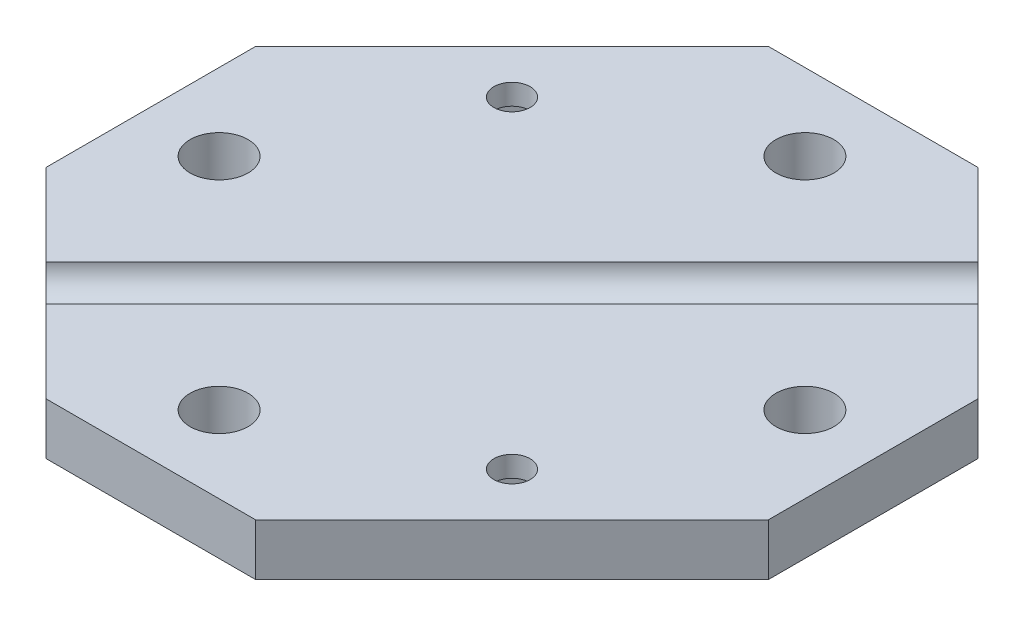
from build123d import *

# Parameters (mm, degrees)
SKETCH1_R           = 2.8
BOSS_EXTRUDE1_DEPTH = 5
CUT_EXTRUDE1_REACH  = 80.329
CUT_EXTRUDE2_START  = -2
CUT_EXTRUDE2_DEPTH  = 3
CUT_EXTRUDE3_REACH  = 59.217
SKETCH6_R           = 1.75


with BuildPart() as part:
    # Sketch1 → Boss-Extrude1 (new body)
    with BuildSketch(Plane(origin=(0, 0, 0), x_dir=(1, 0, 0), z_dir=(0, 1, 0))):
        Polygon((-40.303943114, 15.555205773), (-15.555205773, 40.303943114), (4.694794227, 40.303943114), (24.042773974, 20.955963368), (24.042773974, 0.705963368), (-0.705963368, -24.042773974), (-20.955963368, -24.042773974), (-40.303943114, -4.694794227), align=None)
        with Locations(Location((-11.666118476, -16.618152771, 0), (0, 0, 270))):
            Circle(SKETCH1_R, mode=Mode.SUBTRACT)
        with Locations(Location((16.618152771, 11.666118476, 0), (0, 0, 270))):
            Circle(SKETCH1_R, mode=Mode.SUBTRACT)
        with Locations(Location((-4.595050664, 32.879321912, 0), (0, 0, 270))):
            Circle(SKETCH1_R, mode=Mode.SUBTRACT)
        with Locations(Location((-32.879321912, 4.595050664, 0), (0, 0, 270))):
            Circle(SKETCH1_R, mode=Mode.SUBTRACT)
    extrude(amount=BOSS_EXTRUDE1_DEPTH)

    # Sketch4 → Cut-Extrude1 (cut, up to next)
    with BuildSketch(Plane(origin=(22.499368671, 0, -22.499368671), x_dir=(-0.7071067811865465, 0, -0.7071067811865487), z_dir=(0.7071067811865487, 0, -0.7071067811865465)), mode=Mode.PRIVATE) as cut_extrude1_sk1:
        with BuildLine():
            Line((13.998382969, 5), (8.998382969, 5))
            ThreePointArc((8.998382969, 5), (11.498382969, 2.5), (13.998382969, 5))
        make_face()
    cut_extrude1_tool1 = extrude(cut_extrude1_sk1.sketch, amount=-CUT_EXTRUDE1_REACH, mode=Mode.PRIVATE) & part.part
    add(cut_extrude1_tool1.solids().sort_by_distance((14.368784, 3.938967, -30.629953))[0], mode=Mode.SUBTRACT)

    # Sketch5 → Cut-Extrude2 (cut)
    with BuildSketch(Plane(origin=(0, 5, 0), x_dir=(1, 0, 0), z_dir=(0, 1, 0)).offset(CUT_EXTRUDE2_START)):
        Polygon((-21.359918501, 26.013949012), (-24.538680455, 26.865695711), (-26.865695711, 24.538680455), (-26.013949012, 21.359918501), (-22.835187058, 20.508171802), (-20.508171802, 22.835187058), align=None)
        Polygon((9.752779871, -5.09874936), (6.574017917, -4.247002661), (4.247002661, -6.574017917), (5.09874936, -9.752779871), (8.277511314, -10.60452657), (10.60452657, -8.277511314), align=None)
    extrude(amount=-CUT_EXTRUDE2_DEPTH, mode=Mode.SUBTRACT)

    # Sketch6 → Cut-Extrude3 (cut, up to next)
    with BuildSketch(Plane(origin=(0, 5, 0), x_dir=(1, 0, 0), z_dir=(0, 1, 0)), mode=Mode.PRIVATE) as cut_extrude3_sk1:
        with Locations(Location((-23.686933757, 23.686933757, 0), (0, 0, 270))):
            Circle(SKETCH6_R)
    cut_extrude3_tool1 = extrude(cut_extrude3_sk1.sketch, amount=-CUT_EXTRUDE3_REACH, mode=Mode.PRIVATE) & part.part
    # Sketch6 → Cut-Extrude3 (cut, up to next)
    with BuildSketch(Plane(origin=(0, 5, 0), x_dir=(1, 0, 0), z_dir=(0, 1, 0)), mode=Mode.PRIVATE) as cut_extrude3_sk2:
        with Locations(Location((7.425764616, -7.425764616, 0), (0, 0, 270))):
            Circle(SKETCH6_R)
    cut_extrude3_tool2 = extrude(cut_extrude3_sk2.sketch, amount=-CUT_EXTRUDE3_REACH, mode=Mode.PRIVATE) & part.part
    add(cut_extrude3_tool1.solids().sort_by_distance((-23.686934, 5, -23.686934))[0], mode=Mode.SUBTRACT)
    add(cut_extrude3_tool2.solids().sort_by_distance((7.425765, 5, 7.425765))[0], mode=Mode.SUBTRACT)


solid = part.part
